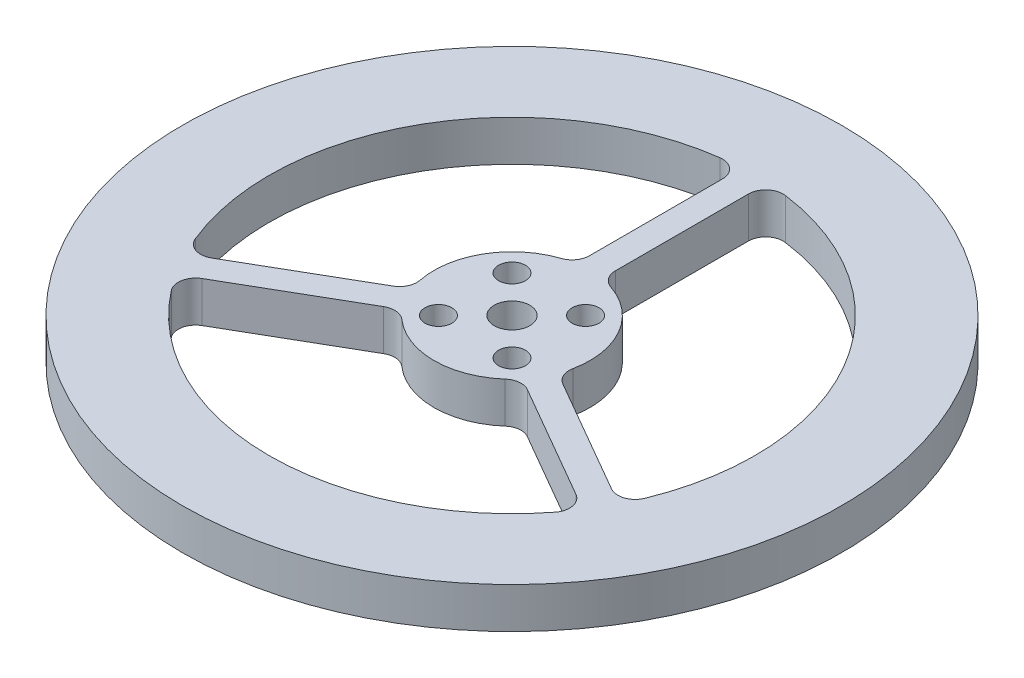
from build123d import *

# Parameters (mm, degrees)
SKETCH1_R           = 38
SKETCH1_R_2         = 28
BOSS_EXTRUDE1_DEPTH = 4.7
SKETCH2_R           = 9
SKETCH2_R_2         = 2.05
SKETCH2_R_3         = 1.55
BOSS_EXTRUDE2_DEPTH = 4.7
SKETCH3_W           = 3
SKETCH3_H           = 20.125880325
BOSS_EXTRUDE3_DEPTH = 4.7
FILLET1_R           = 2
FILLET2_R           = 2


with BuildPart() as part:
    # Sketch1 → Boss-Extrude1 (new body)
    with BuildSketch(Plane(origin=(0, 0, 0), x_dir=(1, 0, 0), z_dir=(0, 1, 0))):
        with Locations(Location((0, 0, 0), (0, 0, 270))):
            Circle(SKETCH1_R)
        with Locations(Location((0, 0, 0), (0, 0, 270))):
            Circle(SKETCH1_R_2, mode=Mode.SUBTRACT)
    extrude(amount=BOSS_EXTRUDE1_DEPTH)



with BuildPart() as body_2:
    # Sketch2 → Boss-Extrude2 (new body)
    with BuildSketch(Plane(origin=(0, 0, 0), x_dir=(1, 0, 0), z_dir=(0, 1, 0))):
        with Locations(Location((0, 0, 0), (0, 0, 270))):
            Circle(SKETCH2_R)
        with Locations(Location((0, 0, 0), (0, 0, 270))):
            Circle(SKETCH2_R_2, mode=Mode.SUBTRACT)
        with Locations(Location((-4.242640687, 4.242640687, 0), (0, 0, 270))):
            Circle(SKETCH2_R_3, mode=Mode.SUBTRACT)
        with Locations(Location((-4.242640687, -4.242640687, 0), (0, 0, 270))):
            Circle(SKETCH2_R_3, mode=Mode.SUBTRACT)
        with Locations(Location((4.242640687, -4.242640687, 0), (0, 0, 270))):
            Circle(SKETCH2_R_3, mode=Mode.SUBTRACT)
        with Locations(Location((4.242640687, 4.242640687, 0), (0, 0, 270))):
            Circle(SKETCH2_R_3, mode=Mode.SUBTRACT)
    extrude(amount=BOSS_EXTRUDE2_DEPTH)


with BuildPart() as part_1:
    add(part.part)

    add(body_2.part)  # Boss-Extrude3 merges body 2
    # Sketch3 → Boss-Extrude3 (add)
    with BuildSketch(Plane(origin=(0, 0, 0), x_dir=(1, 0, 0), z_dir=(0, 1, 0))):
        with Locations((0, 18.937059838)):
            Rectangle(SKETCH3_W, SKETCH3_H)
        Polygon((25.86473671, -13.200961894), (24.36473671, -15.799038106), (6.935213074, -5.736097943), (8.435213074, -3.138021732), align=None)
        Polygon((-24.36473671, -15.799038106), (-25.86473671, -13.200961894), (-8.435213074, -3.138021732), (-6.935213074, -5.736097943), align=None)
    extrude(amount=BOSS_EXTRUDE3_DEPTH)

    # Fillet1
    fillet1_edges = [part_1.edges().sort_by_distance(p)[0] for p in [
        (1.5, 2.35, -27.95979256),
        (-1.5, 2.35, -27.95979256),
        (24.963890642, 2.35, 12.680858174),
        (23.463890642, 2.35, 15.278934386),
        (-23.463890642, 2.35, 15.278934386),
        (-24.963890642, 2.35, 12.680858174),
    ]]
    fillet(fillet1_edges, radius=FILLET1_R)

    # Fillet2
    fillet2_edges = [part_1.edges().sort_by_distance(p)[0] for p in [
        (-1.5, 2.35, -8.874119675),
        (1.5, 2.35, -8.874119675),
        (8.435213074, 2.35, 3.138021732),
        (6.935213074, 2.35, 5.736097943),
        (-6.935213074, 2.35, 5.736097943),
        (-8.435213074, 2.35, 3.138021732),
    ]]
    fillet(fillet2_edges, radius=FILLET2_R)


solid = part_1.part
